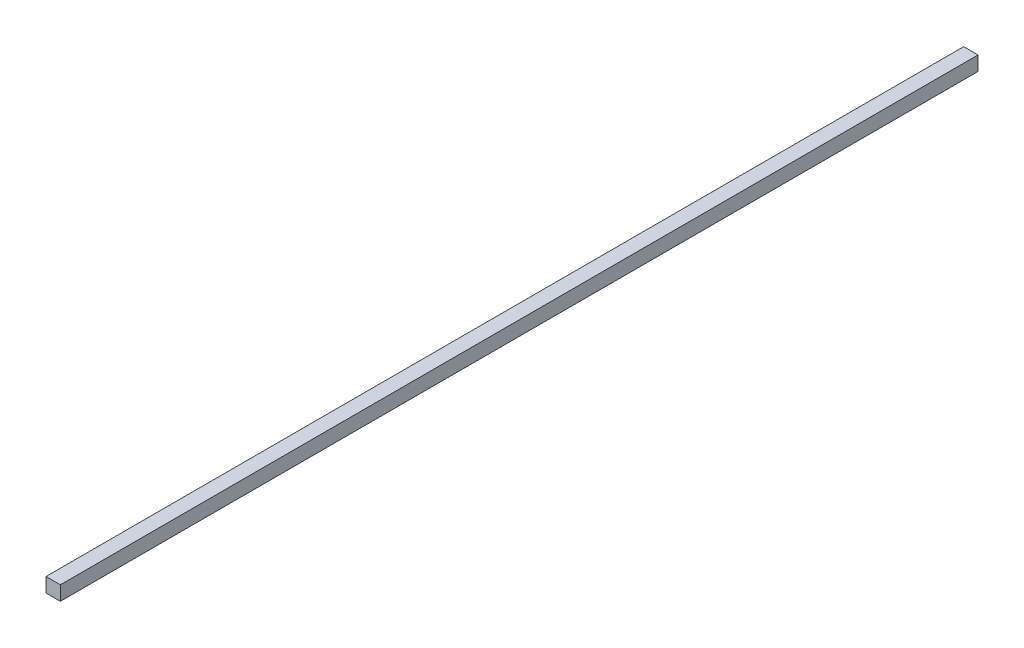
from build123d import *

# Parameters (mm, degrees)
SKETCH1_W      = 38.1
SKETCH1_H      = 38.1
EXTRUDE1_DEPTH = 1219.2


with BuildPart() as part:
    # Sketch1 → Extrude1 (new, symmetric)
    with BuildSketch(Plane.XY):
        Rectangle(SKETCH1_W, SKETCH1_H)
    extrude(amount=EXTRUDE1_DEPTH, both=True)


solid = part.part
